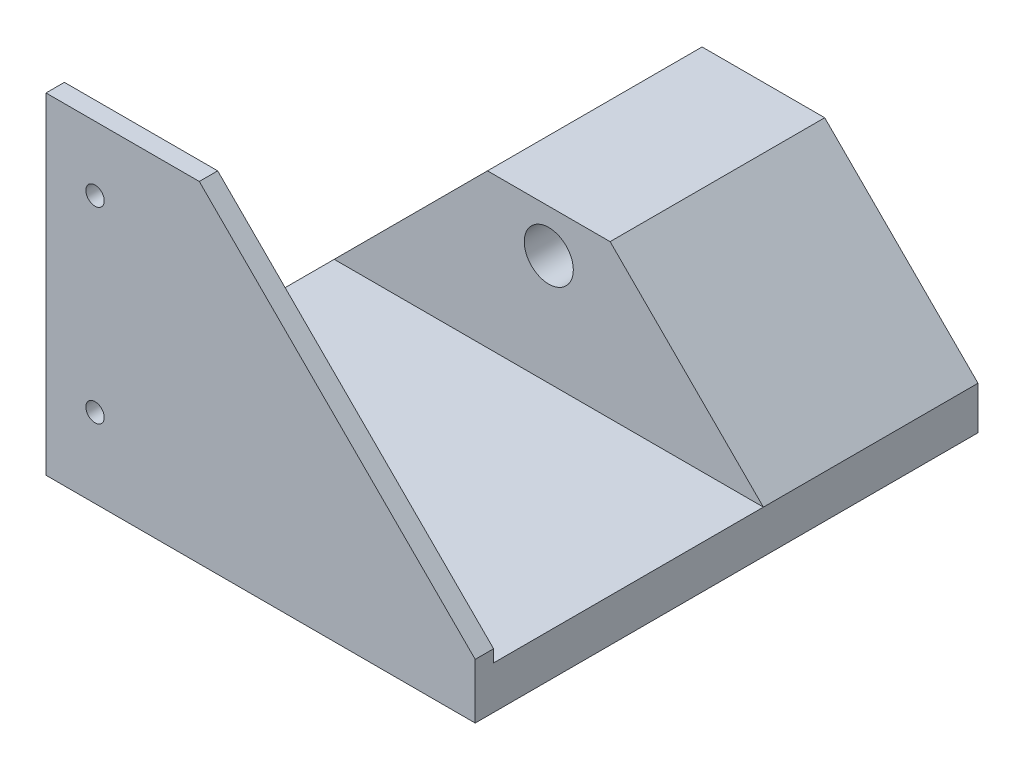
from build123d import *

# Parameters (mm, degrees)
SKETCH1_W           = 70
SKETCH1_H           = 35
BOSS_EXTRUDE1_DEPTH = 32
SKETCH2_R           = 4
CUT_EXTRUDE1_DEPTH  = 40
CHAMFER1_SIZE       = 25
SKETCH3_W           = 70
SKETCH3_H           = 7
BOSS_EXTRUDE2_DEPTH = 47
SKETCH4_W           = 70
SKETCH4_H           = 3
BOSS_EXTRUDE3_DEPTH = 47
SKETCH6_R           = 1.5
CUT_EXTRUDE3_DEPTH  = 10
CHAMFER2_SIZE       = 45


with BuildPart() as part:
    # Sketch1 → Boss-Extrude1 (new body)
    with BuildSketch(Plane(origin=(0, 0, 0), x_dir=(1, 0, 0), z_dir=(0, 1, 0))):
        Rectangle(SKETCH1_W, SKETCH1_H)
    extrude(amount=BOSS_EXTRUDE1_DEPTH)

    # Sketch2 → Cut-Extrude1 (cut)
    with BuildSketch(Plane.XY.offset(17.5)):
        with Locations((0, 25)):
            Circle(SKETCH2_R)
    extrude(amount=-CUT_EXTRUDE1_DEPTH, mode=Mode.SUBTRACT)

    # Chamfer1
    chamfer1_edges = [part.edges().sort_by_distance(p)[0] for p in [
        (-35, 32, 0),
        (35, 32, 0),
    ]]
    chamfer(chamfer1_edges, length=CHAMFER1_SIZE)

    # Sketch3 → Boss-Extrude2 (add)
    with BuildSketch(Plane.XY.offset(17.5)):
        with Locations((0, 3.5)):
            Rectangle(SKETCH3_W, SKETCH3_H)
    extrude(amount=BOSS_EXTRUDE2_DEPTH)

    # Sketch4 → Boss-Extrude3 (add)
    with BuildSketch(Plane(origin=(0, 7, 0), x_dir=(1, 0, 0), z_dir=(0, 1, 0))):
        with Locations((0, -63)):
            Rectangle(SKETCH4_W, SKETCH4_H)
    extrude(amount=BOSS_EXTRUDE3_DEPTH)

    # Sketch6 → Cut-Extrude3 (cut)
    with BuildSketch(Plane.XY.offset(64.5)):
        with Locations((-27, 12.9)):
            Circle(SKETCH6_R)
        with Locations((-27, 43.5)):
            Circle(SKETCH6_R)
    extrude(amount=-CUT_EXTRUDE3_DEPTH, mode=Mode.SUBTRACT)

    # Chamfer2
    chamfer2_edges = [part.edges().sort_by_distance(p)[0] for p in [
        (35, 54, 63),
    ]]
    chamfer(chamfer2_edges, length=CHAMFER2_SIZE)


solid = part.part
